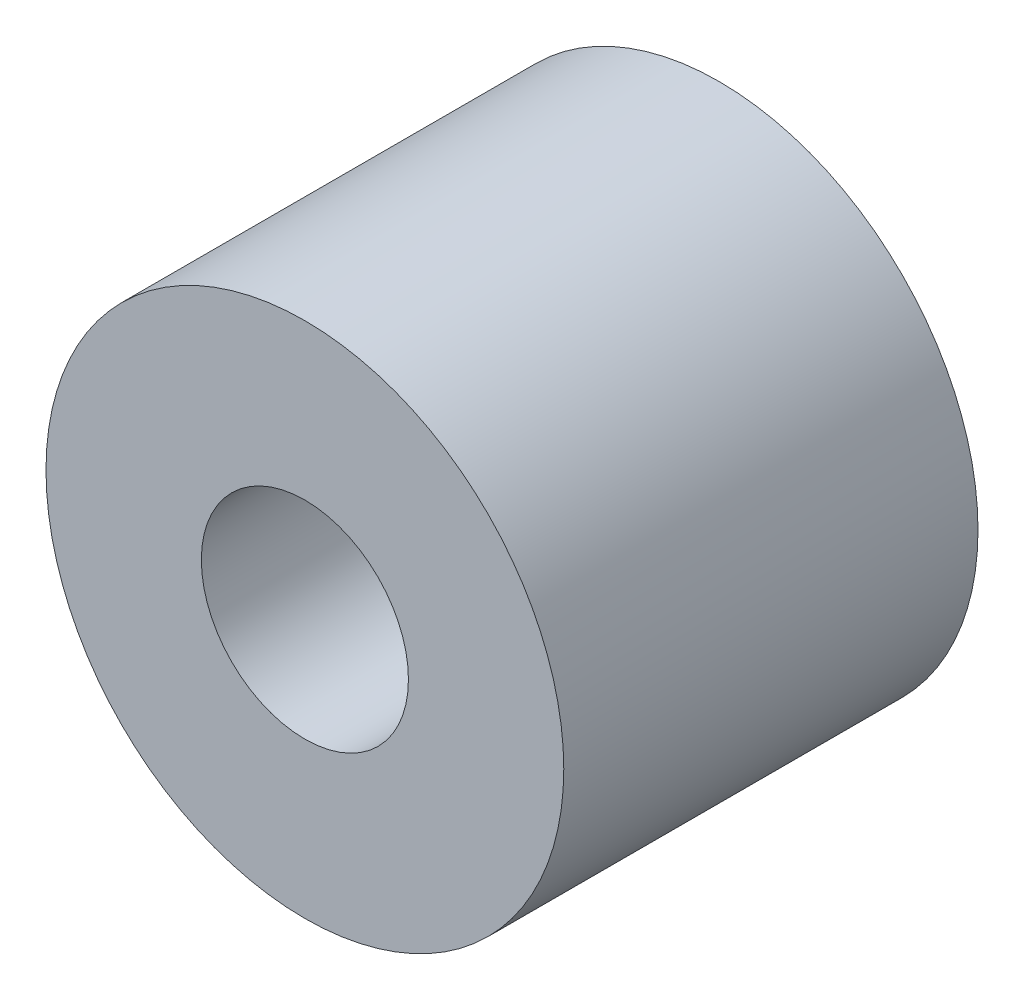
from build123d import *

# Parameters (mm, degrees)
SKETCH1_R           = 2.5
SKETCH1_R_2         = 1
BOSS_EXTRUDE1_DEPTH = 4


with BuildPart() as part:
    # Sketch1 → Boss-Extrude1 (new body)
    with BuildSketch(Plane.XY):
        Circle(SKETCH1_R)
        Circle(SKETCH1_R_2, mode=Mode.SUBTRACT)
    extrude(amount=BOSS_EXTRUDE1_DEPTH)


solid = part.part
